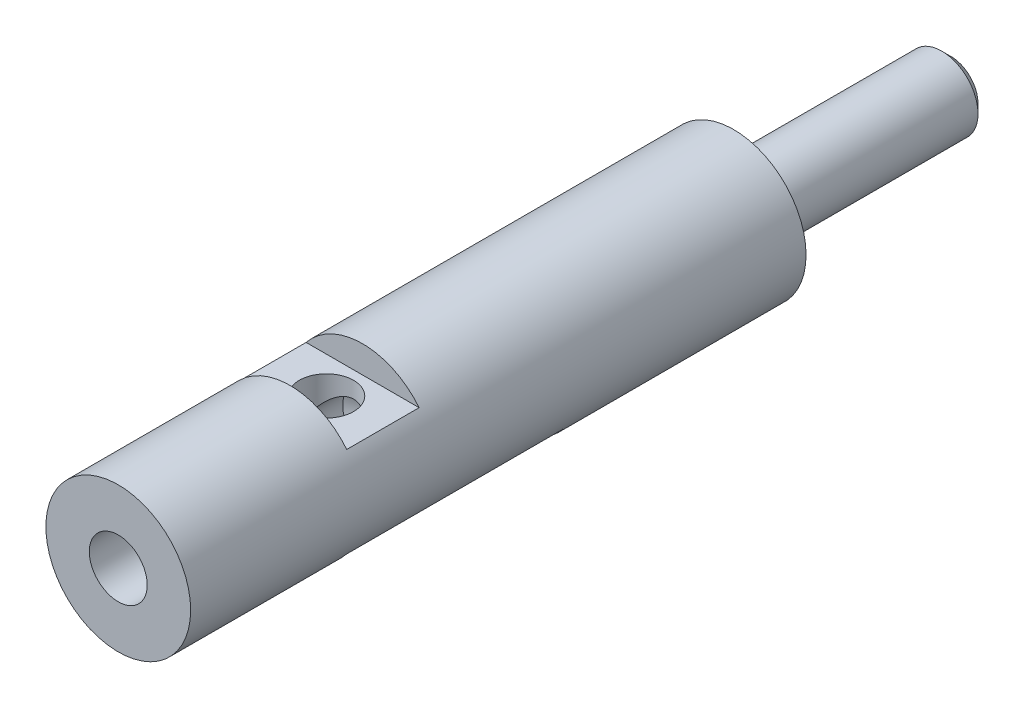
from build123d import *

# Parameters (mm, degrees)
SKETCH1_R                      = 4
BOSS_EXTRUDE1_DEPTH            = 34
SKETCH2_R                      = 2
BOSS_EXTRUDE2_DEPTH            = 12
CHAMFER1_SIZE                  = 0.5
F_3_2_3_2_DIAMETER_HOLE1_D     = 3.2
F_3_2_3_2_DIAMETER_HOLE1_DEPTH = 14
F_3_2_3_2_DIAMETER_HOLE1_TIP   = 0.96137699
CUT_EXTRUDE1_DEPTH             = 47.346520905
CUT_EXTRUDE1_DEPTH_BACK        = 47.346520905
SKETCH5_W                      = 12
SKETCH5_H                      = 1.5
SKETCH5_W_2                    = 4
F_3_0_3_DIAMETER_HOLE1_REACH   = 48.629
F_3_0_3_DIAMETER_HOLE1_BORE_R  = 1.5


with BuildPart() as part:
    # Sketch1 → Boss-Extrude1 (new body)
    with BuildSketch(Plane.XY):
        Circle(SKETCH1_R)
    extrude(amount=-BOSS_EXTRUDE1_DEPTH)

    # Sketch2 → Boss-Extrude2 (add)
    with BuildSketch(Plane(origin=(0, 0, -34), x_dir=(-1, 0, 0), z_dir=(0, 0, -1))):
        with Locations(Location((0, 0, 0), (0, 0, 180))):
            Circle(SKETCH2_R)
    extrude(amount=BOSS_EXTRUDE2_DEPTH)

    # Chamfer1
    chamfer1_edges = [part.edges().sort_by_distance(p)[0] for p in [
        (-2, 0, -46),
    ]]
    chamfer(chamfer1_edges, length=CHAMFER1_SIZE)

    # Ø3.2 (3.2) Diameter Hole1
    with Locations(Plane.XY):
        with Locations((0, 0)):
            Hole(F_3_2_3_2_DIAMETER_HOLE1_D / 2, depth=F_3_2_3_2_DIAMETER_HOLE1_DEPTH)
            with Locations((0, 0, -(F_3_2_3_2_DIAMETER_HOLE1_DEPTH + F_3_2_3_2_DIAMETER_HOLE1_TIP / 2))):  # 118° drill point
                Cone(0, F_3_2_3_2_DIAMETER_HOLE1_D / 2, F_3_2_3_2_DIAMETER_HOLE1_TIP, mode=Mode.SUBTRACT)

    # Sketch5 → Cut-Extrude1 (cut, two sides: drawn at the far end of the back side and taken through both)
    with BuildSketch(Plane(origin=(0, 0, 0), x_dir=(0, 0, -1), z_dir=(1, 0, 0)).offset(-CUT_EXTRUDE1_DEPTH_BACK)):
        with Locations((15.5, -3.25)):
            Rectangle(SKETCH5_W, SKETCH5_H)
        with Locations((11.5, 3.25)):
            Rectangle(SKETCH5_W_2, SKETCH5_H)
    extrude(amount=CUT_EXTRUDE1_DEPTH + CUT_EXTRUDE1_DEPTH_BACK, mode=Mode.SUBTRACT)

    # Ø3.0 (3) Diameter Hole1 bore → Ø3.0 (3) Diameter Hole1 (cut, up to next)
    with BuildSketch(Plane(origin=(0, 2.5, 0), x_dir=(1, 0, 0), z_dir=(0, 1, 0)), mode=Mode.PRIVATE) as f_3_0_3_diameter_hole1_sk1:
        with Locations((0, 11.5)):
            Circle(F_3_0_3_DIAMETER_HOLE1_BORE_R)
    f_3_0_3_diameter_hole1_tool1 = extrude(f_3_0_3_diameter_hole1_sk1.sketch, amount=-F_3_0_3_DIAMETER_HOLE1_REACH, mode=Mode.PRIVATE) & part.part
    add(f_3_0_3_diameter_hole1_tool1.solids().sort_by_distance((0, 2.5, -11.5))[0], mode=Mode.SUBTRACT)


solid = part.part
